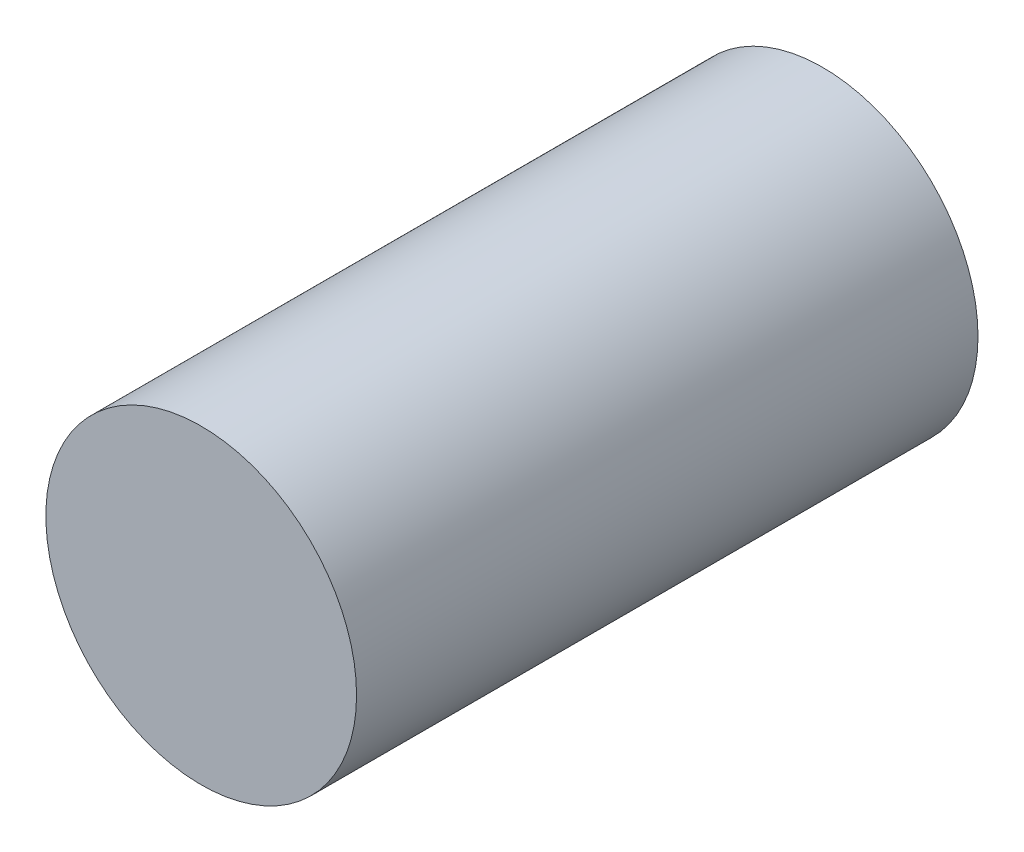
from build123d import *

# Parameters (mm, degrees)
SKETCH1_R           = 6.35
BOSS_EXTRUDE1_DEPTH = 25.4


with BuildPart() as part:
    # Sketch1 → Boss-Extrude1 (new body)
    with BuildSketch(Plane.XY):
        with Locations((-12.740923488, 14.232242724)):
            Circle(SKETCH1_R)
    extrude(amount=BOSS_EXTRUDE1_DEPTH)


solid = part.part
